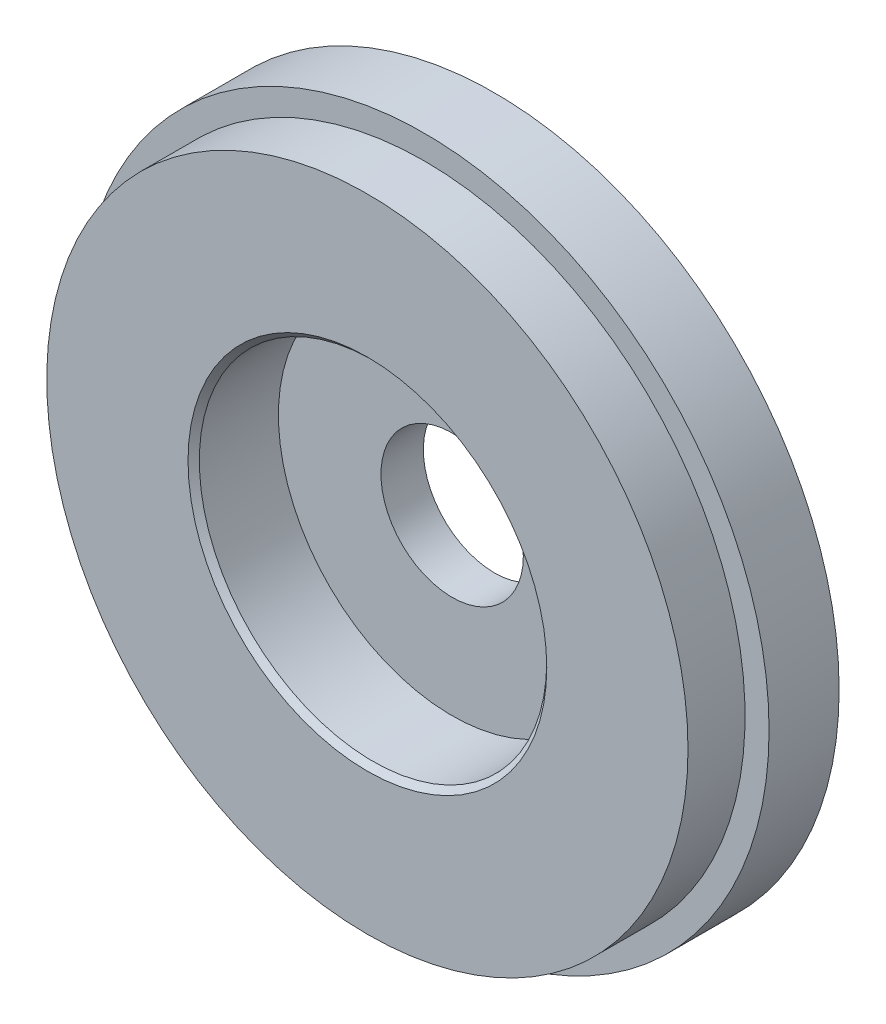
from build123d import *

# Parameters (mm, degrees)
EXTRUDE_START       = 2.5
SKETCH_1_R          = 12.2
EXTRUDE_1_DEPTH     = 2.48
EXTRUDE_START_2     = 4.98
SKETCH_2_R          = 11.35
EXTRUDE_2_DEPTH     = 2.02
CUT_EXTRUDE_START   = 7
SKETCH_3_R          = 6.15
CUT_EXTRUDE_1_DEPTH = 3
CHAMFER_1_SIZE      = 0.2
CUT_EXTRUDE_START_2 = 2.5
SKETCH_4_R          = 2.52
CUT_EXTRUDE_2_DEPTH = 1.5


with BuildPart() as part:
    # 草图1 → 凸台-拉伸1 (new body)
    with BuildSketch(Plane.XY.offset(EXTRUDE_START)):
        with Locations(Location((-22.803986485, 9.350307143, 0), (0, 0, 180))):
            Circle(SKETCH_1_R)
    extrude(amount=EXTRUDE_1_DEPTH)

    # 草图2 → 凸台-拉伸2 (add)
    with BuildSketch(Plane.XY.offset(EXTRUDE_START_2)):
        with Locations(Location((-22.803986485, 9.350307143, 0), (0, 0, 270))):
            Circle(SKETCH_2_R)
    extrude(amount=EXTRUDE_2_DEPTH)

    # 草图3 → 切除-拉伸1 (cut)
    with BuildSketch(Plane.XY.offset(CUT_EXTRUDE_START)):
        with Locations((-22.803986485, 9.350307143)):
            Circle(SKETCH_3_R)
    extrude(amount=-CUT_EXTRUDE_1_DEPTH, mode=Mode.SUBTRACT)

    # 倒角1
    chamfer_1_edges = [part.edges().sort_by_distance(p)[0] for p in [
        (-28.953986485, 9.350307143, 7),
    ]]
    chamfer(chamfer_1_edges, length=CHAMFER_1_SIZE)

    # 草图4 → 切除-拉伸2 (cut)
    with BuildSketch(Plane.XY.offset(CUT_EXTRUDE_START_2)):
        with Locations((-22.803986485, 9.350307143)):
            Circle(SKETCH_4_R)
    extrude(amount=CUT_EXTRUDE_2_DEPTH, mode=Mode.SUBTRACT)


solid = part.part
